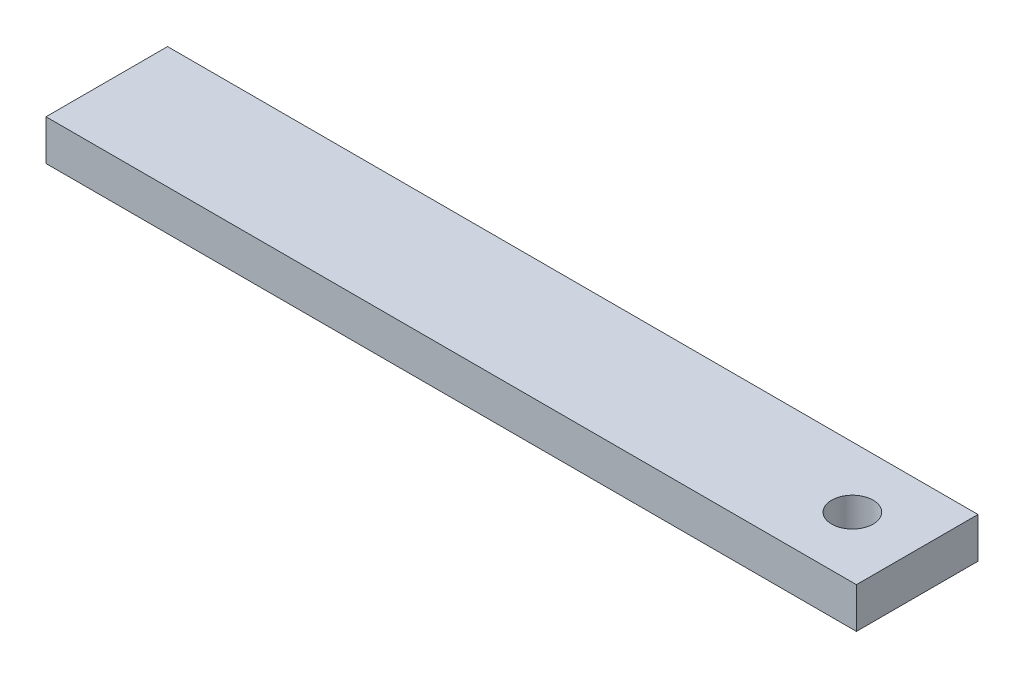
from build123d import *

# Parameters (mm, degrees)
SKETCH1_W           = 200
SKETCH1_H           = 30
BOSS_EXTRUDE1_DEPTH = 10
SKETCH2_R           = 5.125
CUT_EXTRUDE1_DEPTH  = 102.612007165


with BuildPart() as part:
    # Sketch1 → Boss-Extrude1 (new body)
    with BuildSketch(Plane(origin=(0, 0, 0), x_dir=(1, 0, 0), z_dir=(0, 1, 0))):
        Rectangle(SKETCH1_W, SKETCH1_H)
    extrude(amount=BOSS_EXTRUDE1_DEPTH)

    # Sketch2 → Cut-Extrude1 (cut, through all)
    with BuildSketch(Plane(origin=(0, 10, 0), x_dir=(1, 0, 0), z_dir=(0, 1, 0))):
        with Locations(Location((84, 0, 0), (0, 0, 270))):
            Circle(SKETCH2_R)
    extrude(amount=-CUT_EXTRUDE1_DEPTH, mode=Mode.SUBTRACT)


solid = part.part
